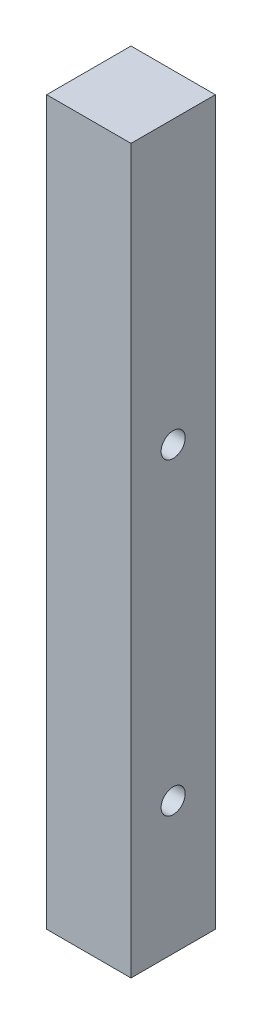
from build123d import *

# Parameters (mm, degrees)
SKETCH1_W           = 70
SKETCH1_H           = 70
BOSS_EXTRUDE1_DEPTH = 600
SKETCH2_R           = 10
CUT_EXTRUDE1_DEPTH  = 119


with BuildPart() as part:
    # Sketch1 → Boss-Extrude1 (new body)
    with BuildSketch(Plane(origin=(0, 0, 0), x_dir=(1, 0, 0), z_dir=(0, 1, 0))):
        with Locations((-35, -35)):
            Rectangle(SKETCH1_W, SKETCH1_H)
    extrude(amount=BOSS_EXTRUDE1_DEPTH)

    # Sketch2 → Cut-Extrude1 (cut)
    with BuildSketch(Plane(origin=(0, 0, 0), x_dir=(0, 0, -1), z_dir=(1, 0, 0))):
        with Locations((-35, 110)):
            Circle(SKETCH2_R)
        with Locations((-35, 366)):
            Circle(SKETCH2_R)
    extrude(amount=-CUT_EXTRUDE1_DEPTH, mode=Mode.SUBTRACT)


solid = part.part
